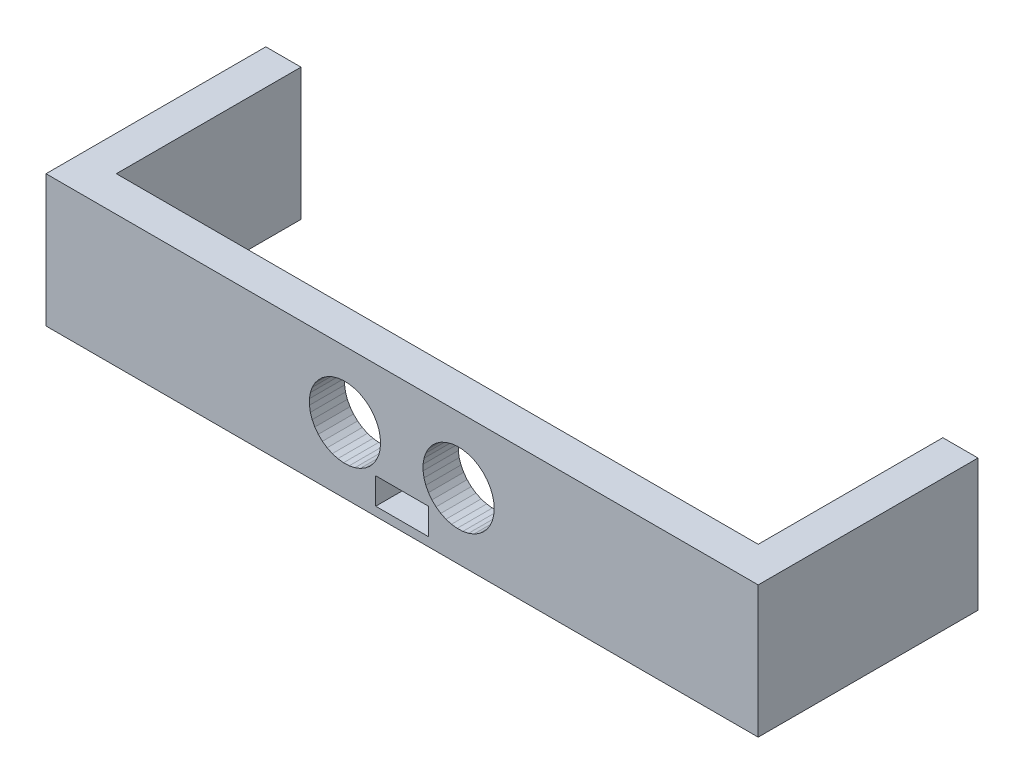
from build123d import *

# Parameters (mm, degrees)
SKETCH1_W           = 162.000000477
SKETCH1_H           = 50.000000745
BOSS_EXTRUDE1_DEPTH = 29.999999329
SKETCH2_W           = 145.999998786
SKETCH2_H           = 41.999999434
CUT_EXTRUDE1_DEPTH  = 173.174330807
CUT_EXTRUDE2_DEPTH  = 173.174330807
SKETCH4_W           = 11.999994517
SKETCH4_H           = 6.000000285
CUT_EXTRUDE3_DEPTH  = 173.174330807
CUT_EXTRUDE4_DEPTH  = 171.02352798


with BuildPart() as part:
    # Sketch1 → Boss-Extrude1 (new body)
    with BuildSketch(Plane(origin=(0, 29.999999329, 0), x_dir=(1, 0, 0), z_dir=(0, 1, 0))):
        with Locations((81.000000239, -25.000000373)):
            Rectangle(SKETCH1_W, SKETCH1_H)
    extrude(amount=-BOSS_EXTRUDE1_DEPTH)

    # Sketch2 → Cut-Extrude1 (cut, through all)
    with BuildSketch(Plane.XZ):
        with Locations((80.999999773, 20.999999717)):
            Rectangle(SKETCH2_W, SKETCH2_H)
    extrude(amount=-CUT_EXTRUDE1_DEPTH, mode=Mode.SUBTRACT)

    # Sketch3 → Cut-Extrude2 (cut, through all)
    with BuildSketch(Plane.XY.offset(50.000000745)):
        Polygon((85.776269436, 14.348221011), (85.985377431, 13.061543927), (86.398161948, 11.825070716), (87.003961205, 10.67082677), (87.78706193, 9.628706612), (88.727198541, 8.725699037), (89.800000191, 7.985194214), (90.977698565, 7.426368073), (92.229790986, 7.063695695), (93.523852527, 6.906569004), (94.826348126, 6.959058344), (96.103563905, 7.21980352), (97.322411835, 7.68205151), (98.451323807, 8.333831094), (99.461063743, 9.158260189), (100.325487554, 10.133987293), (101.022191346, 11.23574283), (101.533144712, 12.434989214), (101.845107973, 13.7006687), (101.949997246, 14.999999665), (101.845107973, 16.299331561), (101.533144712, 17.565010116), (101.022191346, 18.764257431), (100.325487554, 19.866012037), (99.461063743, 20.841740072), (98.451323807, 21.666171029), (97.322411835, 22.317949682), (96.103563905, 22.780196741), (94.826348126, 23.040940985), (93.523852527, 23.093432188), (92.229790986, 22.936303169), (90.977698565, 22.573631257), (89.800000191, 22.014804184), (88.727198541, 21.274300292), (87.78706193, 20.371293649), (87.003961205, 19.32917349), (86.398161948, 18.174929544), (85.985377431, 16.938457265), (85.776269436, 15.651779249), align=None)
    extrude(amount=-CUT_EXTRUDE2_DEPTH, mode=Mode.SUBTRACT)

    # Sketch4 → Cut-Extrude3 (cut, through all)
    with BuildSketch(Plane.XY.offset(50.000000745)):
        with Locations((81.000000239, 5.000000238)):
            Rectangle(SKETCH4_W, SKETCH4_H)
    extrude(amount=-CUT_EXTRUDE3_DEPTH, mode=Mode.SUBTRACT)

    # Sketch5 → Cut-Extrude4 (cut, through all)
    with BuildSketch(Plane(origin=(0, 0, 41.999999434), x_dir=(-1, 0, 0), z_dir=(0, 0, -1))):
        Polygon((-70.253565907, 22.780196741), (-71.472413838, 22.317949682), (-72.60132581, 21.666171029), (-73.611065745, 20.841740072), (-74.475489557, 19.866012037), (-75.172193348, 18.764257431), (-75.683146715, 17.565010116), (-75.995109975, 16.299331561), (-76.099999249, 14.999999665), (-75.995109975, 13.7006687), (-75.683146715, 12.434989214), (-75.172193348, 11.23574283), (-74.475489557, 10.133987293), (-73.611065745, 9.158260189), (-72.60132581, 8.333831094), (-71.472413838, 7.68205151), (-70.253565907, 7.21980352), (-68.976350129, 6.959058344), (-67.673847079, 6.906569004), (-66.379792988, 7.063695695), (-65.127700567, 7.426368073), (-63.950002193, 7.985194214), (-62.877193093, 8.725699037), (-61.937060207, 9.628706612), (-61.153959483, 10.67082677), (-60.548167676, 11.825070716), (-60.135371983, 13.061543927), (-59.926263988, 14.348221011), (-59.926263988, 15.651779249), (-60.135371983, 16.938457265), (-60.548167676, 18.174929544), (-61.153959483, 19.32917349), (-61.937060207, 20.371293649), (-62.877193093, 21.274300292), (-63.950002193, 22.014804184), (-65.127700567, 22.573631257), (-66.379792988, 22.936303169), (-67.673847079, 23.093432188), (-68.976350129, 23.040940985), align=None)
    extrude(amount=-CUT_EXTRUDE4_DEPTH, mode=Mode.SUBTRACT)


solid = part.part
